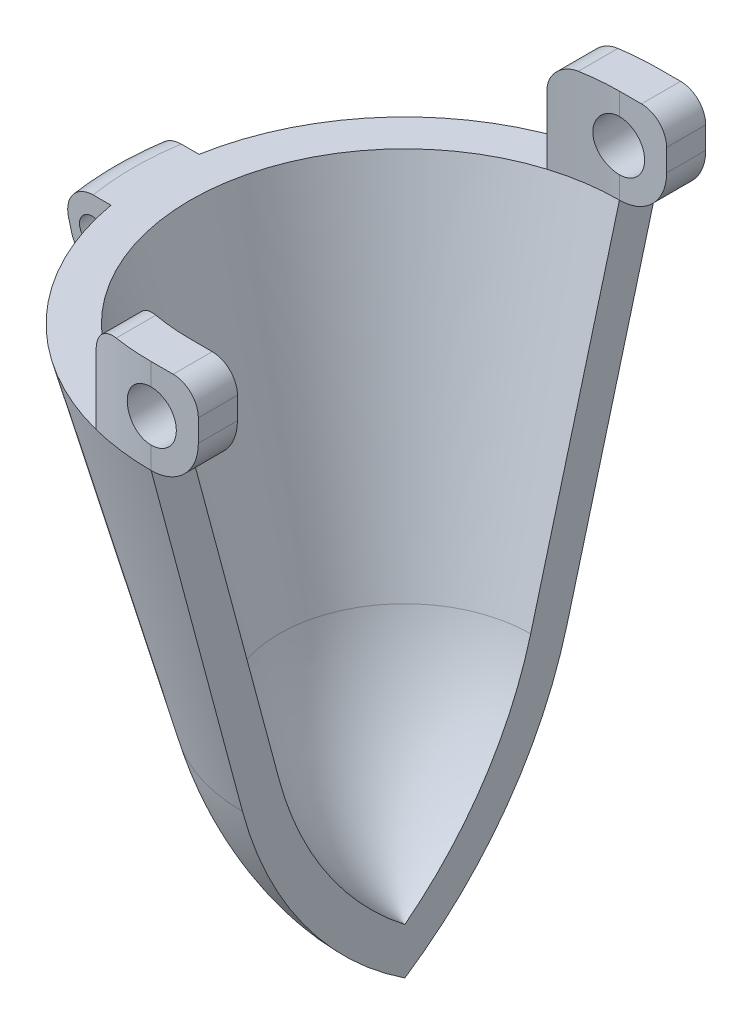
from build123d import *

# Parameters (mm, degrees)
REVOLUCI_N1_ANGLE           = 180
SALIENTE_EXTRUIR1_DEPTH     = 15
CROQUIS4_R                  = 4
CORTAR_EXTRUIR1_DEPTH       = 139.387389496
REVOLUCI_N2_ANGLE           = 10
REVOLUCI_N2_OTHER_WAY_ANGLE = 10
CORTAR_EXTRUIR2_DEPTH       = 10
CROQUIS7_R                  = 2
CORTAR_EXTRUIR3_DEPTH       = 125.891504895
CORTAR_EXTRUIR4_DEPTH       = 141.925841064
REDONDEO1_R                 = 4


with BuildPart() as part:
    # Croquis1 → Revolución1 (revolve)
    with BuildSketch(Plane(origin=(0, 0, 0), x_dir=(0, 0, -1), z_dir=(1, 0, 0))):
        with BuildLine():
            Line((-25.795554958, 35.816642159), (-40.313941934, 90))
            Line((-40.313941934, 90), (-34.102284852, 90))
            Line((-34.102284852, 90), (-20, 37.36955643))
            ThreePointArc((-20, 37.36955643), (-12.468451731, 20.723921943), (0, 7.36955643))
            Line((0, 7.36955643), (0, 0))
            ThreePointArc((0, 0), (-16.178409273, 15.545572574), (-25.795554958, 35.816642159))
        make_face()
    revolve(axis=Axis((0, 7.36955643, 0), (0, -1, 0)), revolution_arc=REVOLUCI_N1_ANGLE)

    # Croquis3 → Saliente-Extruir1 (add)
    with BuildSketch(Plane(origin=(0, 90, 0), x_dir=(1, 0, 0), z_dir=(0, 1, 0))):
        with BuildLine():
            Line((-10, -32.603156782), (-10, -39.053987175))
            ThreePointArc((-10, -39.053987175), (-5.039530881, -39.997712969), (0, -40.313941934))
            Line((0, -40.313941934), (10, -40.313941934))
            Line((10, -40.313941934), (10, -34.102284852))
            Line((10, -34.102284852), (0, -34.102284852))
            ThreePointArc((0, -34.102284852), (-5.055872451, -33.72542047), (-10, -32.603156782))
        make_face()
        with BuildLine():
            Line((-10, 32.603156782), (-10, 39.053987175))
            ThreePointArc((-10, 39.053987175), (-5.039530881, 39.997712969), (0, 40.313941934))
            Line((0, 40.313941934), (10, 40.313941934))
            Line((10, 40.313941934), (10, 34.102284852))
            Line((10, 34.102284852), (0, 34.102284852))
            ThreePointArc((0, 34.102284852), (-5.055872451, 33.72542047), (-10, 32.603156782))
        make_face()
    extrude(amount=SALIENTE_EXTRUIR1_DEPTH)

    # Croquis4 → Cortar-Extruir1 (cut, through all)
    with BuildSketch(Plane.XY.offset(40.313941934)):
        with Locations(Location((0, 97.5, 0), (0, 0, 270))):
            Circle(CROQUIS4_R)
    extrude(amount=-CORTAR_EXTRUIR1_DEPTH, mode=Mode.SUBTRACT)

    # Croquis5 → Revolución2 (revolve)
    with BuildSketch(Plane.XY):
        Polygon((-40.313941934, 90), (-48.313941934, 90), (-45.63445001, 80), (-37.63445001, 80), align=None)
    revolve(axis=Axis((0, 0, 0), (0, 1, 0)), revolution_arc=REVOLUCI_N2_ANGLE)

    # Croquis5 → Revolución2 other way (revolve)
    with BuildSketch(Plane.XY):
        Polygon((-40.313941934, 90), (-48.313941934, 90), (-45.63445001, 80), (-37.63445001, 80), align=None)
    revolve(axis=Axis((0, 0, 0), (0, -1, 0)), revolution_arc=REVOLUCI_N2_OTHER_WAY_ANGLE)

    # Croquis6 → Cortar-Extruir2 (cut)
    with BuildSketch(Plane(origin=(0, 90, 0), x_dir=(1, 0, 0), z_dir=(0, 1, 0))):
        Polygon((-39.701482571, 7.000442551), (-47.80408758, 7.000442551), (-47.579944596, 8.389627973), align=None)
        Polygon((-39.701482571, -7.000442551), (-47.80408758, -7.000442551), (-47.579944596, -8.389627973), align=None)
    extrude(amount=-CORTAR_EXTRUIR2_DEPTH, mode=Mode.SUBTRACT)


with BuildPart() as cortar_extruir2_kept_piece:
    # of the separate pieces the step leaves, the one the design keeps (cortar_extruir2_pieces_kept)
    add(part.part.solids().sort_by_distance((0, 0, 0))[0])

    # Croquis7 → Cortar-Extruir3 (cut, through all)
    with BuildSketch(Plane.XY.offset(7.000442551)):
        with Locations((-42.701482571, 85)):
            Circle(CROQUIS7_R)
    extrude(amount=-CORTAR_EXTRUIR3_DEPTH, mode=Mode.SUBTRACT)

    # Croquis8 → Cortar-Extruir4 (cut, through all)
    with BuildSketch(Plane.XY.offset(40.313941934)):
        with BuildLine():
            Line((7.5, 97.5), (7.5, 105))
            Line((7.5, 105), (10, 105))
            Line((10, 105), (10, 90))
            Line((10, 90), (0, 90))
            ThreePointArc((0, 90), (5.303300859, 92.196699141), (7.5, 97.5))
        make_face()
    extrude(amount=-CORTAR_EXTRUIR4_DEPTH, mode=Mode.SUBTRACT)

    # Redondeo1
    redondeo1_edges = [cortar_extruir2_kept_piece.edges().sort_by_distance(p)[0] for p in [
        (7.5, 105, -37.208113393),
        (7.5, 105, 37.208113393),
        (-10, 105, -35.828571978),
        (-10, 105, 35.828571978),
        (-45.63445001, 80, 0),
        (-48.313941934, 90, 0),
    ]]
    fillet(redondeo1_edges, radius=REDONDEO1_R)


solid = cortar_extruir2_kept_piece.part
